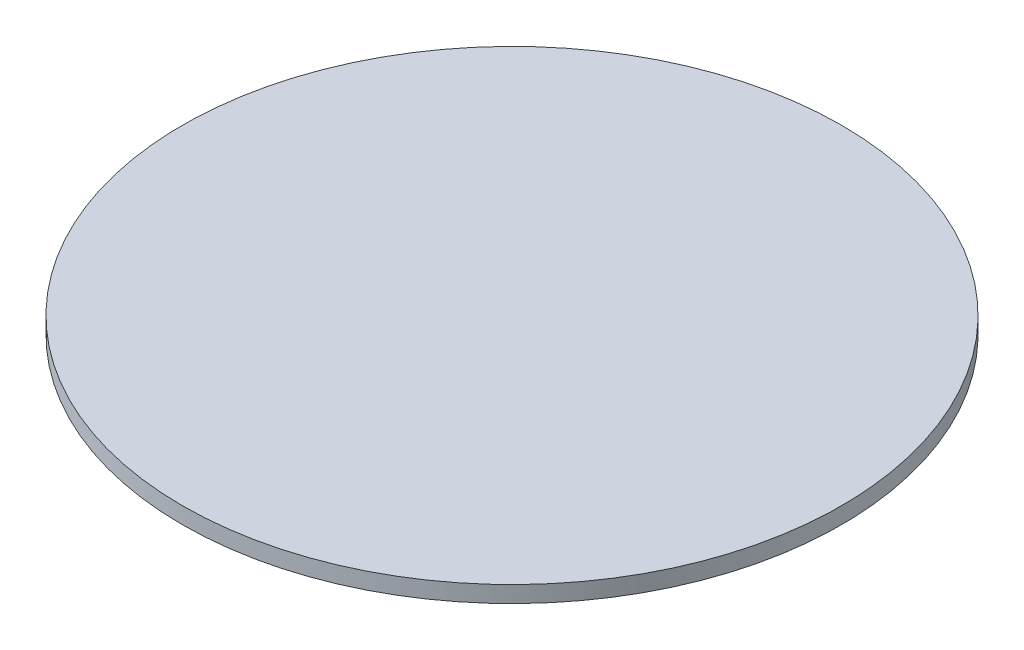
from build123d import *

# Parameters (mm, degrees)
CROQUIS1_R              = 60
SALIENTE_EXTRUIR1_DEPTH = 3


with BuildPart() as part:
    # Croquis1 → Saliente-Extruir1 (new body)
    with BuildSketch(Plane(origin=(0, 0, 0), x_dir=(1, 0, 0), z_dir=(0, 1, 0))):
        with Locations(Location((0, 0, 0), (0, 0, 270))):
            Circle(CROQUIS1_R)
    extrude(amount=SALIENTE_EXTRUIR1_DEPTH)


solid = part.part
